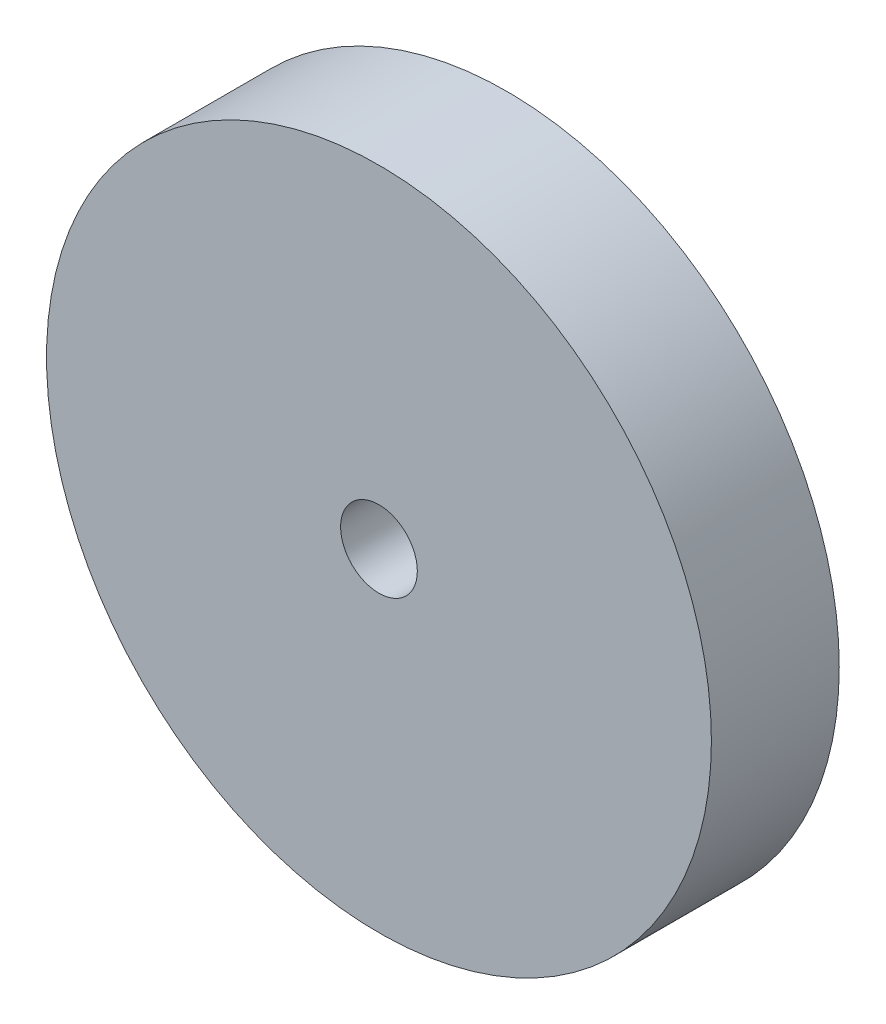
from build123d import *

# Parameters (mm, degrees)
ESQUISSE1_R        = 26
ESQUISSE1_R_2      = 3
BOSS_EXTRU_1_DEPTH = 10


with BuildPart() as part:
    # Esquisse1 → Boss.-Extru.1 (new body)
    with BuildSketch(Plane.XY):
        Circle(ESQUISSE1_R)
        Circle(ESQUISSE1_R_2, mode=Mode.SUBTRACT)
    extrude(amount=BOSS_EXTRU_1_DEPTH)


solid = part.part
